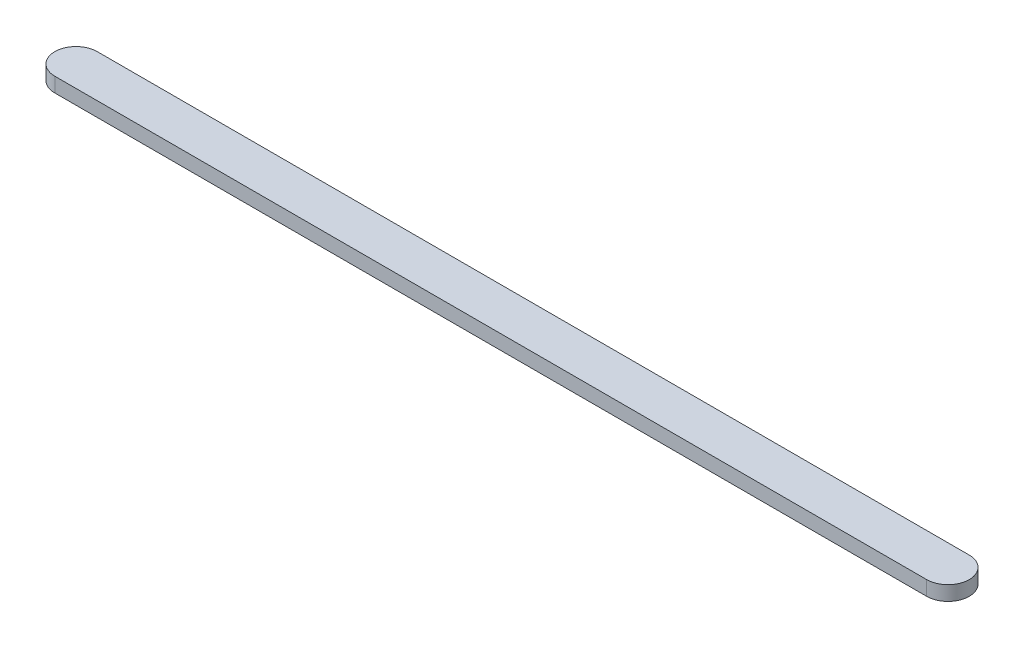
from build123d import *

# Parameters (mm, degrees)
BOSS_EXTRUDE1_DEPTH = 2.54


with BuildPart() as part:
    # Sketch1 → Boss-Extrude1 (new body)
    with BuildSketch(Plane(origin=(0, 0, 0), x_dir=(1, 0, 0), z_dir=(0, 1, 0))):
        with BuildLine():
            Line((0, 3.716555184), (152.4, 3.716555184))
            ThreePointArc((152.4, 3.716555184), (156.116555184, 0), (152.4, -3.716555184))
            Line((152.4, -3.716555184), (0, -3.716555184))
            ThreePointArc((0, -3.716555184), (-3.716555184, 0), (0, 3.716555184))
        make_face()
    extrude(amount=BOSS_EXTRUDE1_DEPTH)


solid = part.part
